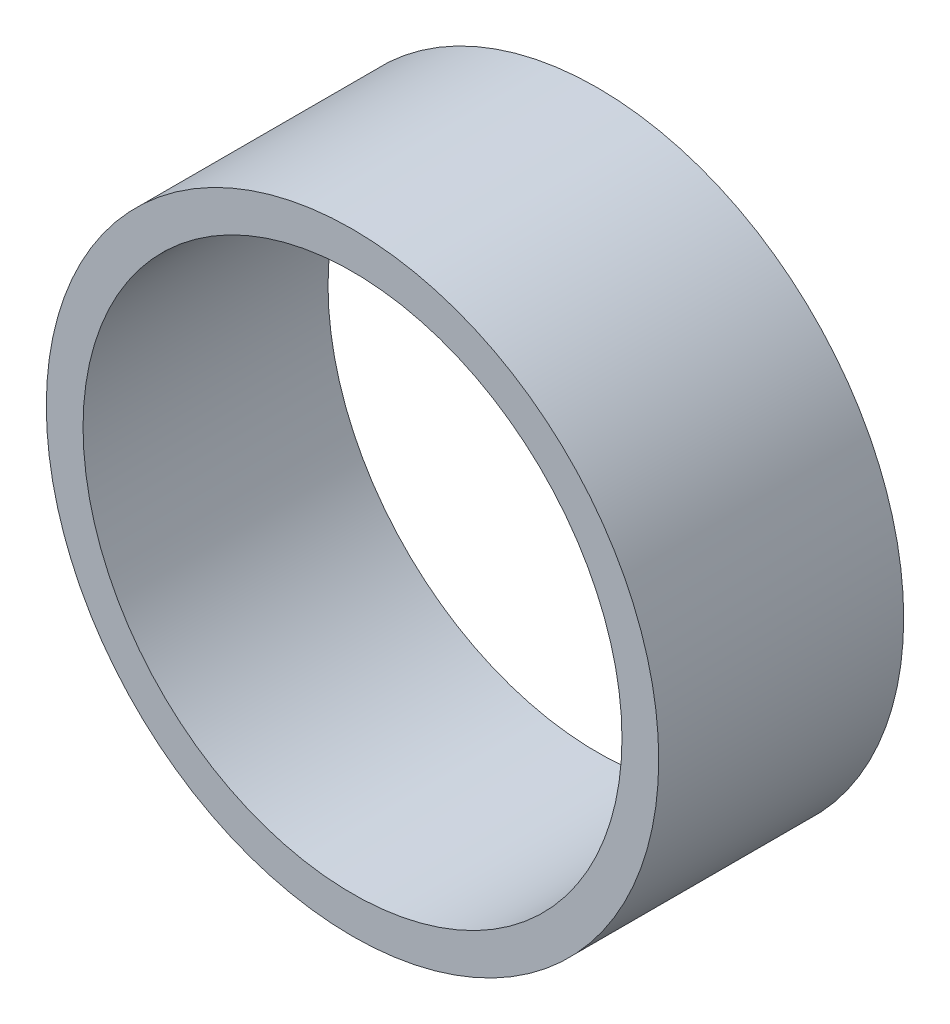
from build123d import *

# Parameters (mm, degrees)
SKETCH1_R           = 25
SKETCH1_R_2         = 22
BOSS_EXTRUDE1_DEPTH = 20


with BuildPart() as part:
    # Sketch1 → Boss-Extrude1 (new body)
    with BuildSketch(Plane.XY):
        Circle(SKETCH1_R)
        Circle(SKETCH1_R_2, mode=Mode.SUBTRACT)
    extrude(amount=BOSS_EXTRUDE1_DEPTH)


solid = part.part
